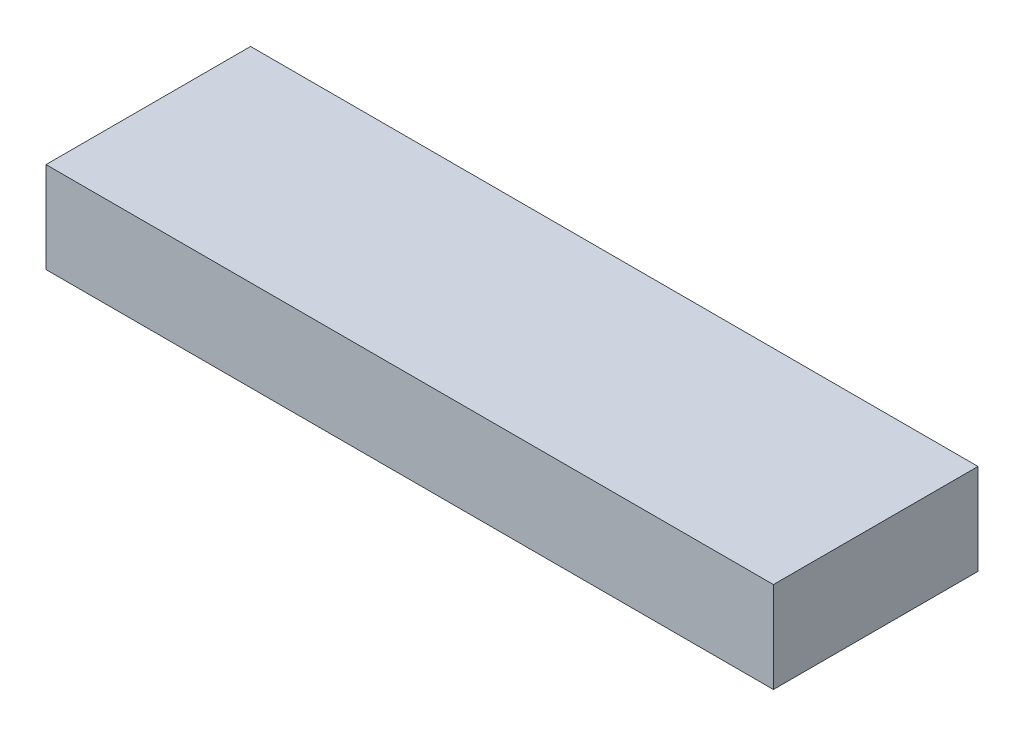
from build123d import *

# Parameters (mm, degrees)
SKETCH1_W           = 101.6
SKETCH1_H           = 12.7
BOSS_EXTRUDE1_DEPTH = 28.575


with BuildPart() as part:
    # Sketch1 → Boss-Extrude1 (new body)
    with BuildSketch(Plane.XY):
        with Locations((-177.288766336, -457.2)):
            Rectangle(SKETCH1_W, SKETCH1_H)
    extrude(amount=BOSS_EXTRUDE1_DEPTH)


solid = part.part
